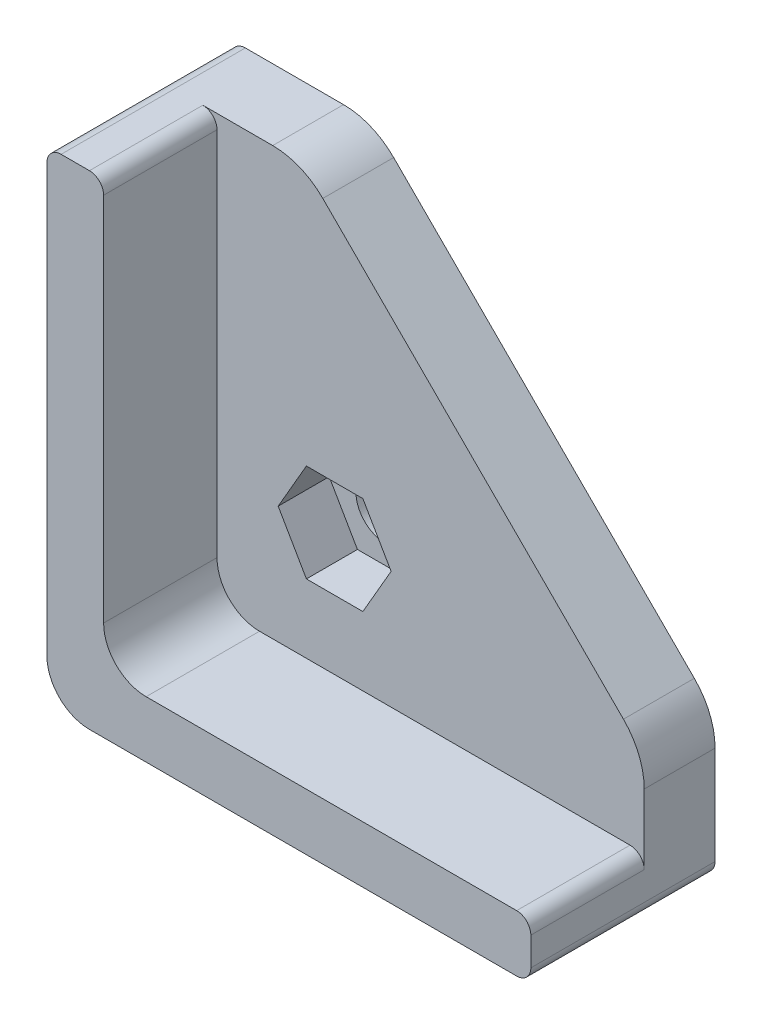
from build123d import *

# Parameters (mm, degrees)
SKETCH1_R           = 2.1
BOSS_EXTRUDE1_DEPTH = 5
BOSS_EXTRUDE2_DEPTH = 8
FILLET1_R           = 3
CUT_EXTRUDE1_DEPTH  = 3.6
FILLET2_R           = 5
FILLET3_R           = 1


with BuildPart() as part:
    # Sketch1 → Boss-Extrude1 (new body)
    with BuildSketch(Plane.XY):
        Polygon((257.428056395, -9.677220034), (223.285920771, -9.677220034), (223.285920771, 24.46491559), (233.285920771, 24.46491559), (257.428056395, 0.322779966), align=None)
        with Locations((235.585920771, 2.622779966)):
            Circle(SKETCH1_R, mode=Mode.SUBTRACT)
    extrude(amount=BOSS_EXTRUDE1_DEPTH)

    # Sketch2 → Boss-Extrude2 (add)
    with BuildSketch(Plane.XY.offset(5)):
        Polygon((257.428056395, -9.677220034), (223.285920771, -9.677220034), (223.285920771, 24.46491559), (227.285920771, 24.46491559), (227.285920771, -5.677220034), (257.428056395, -5.677220034), align=None)
    extrude(amount=BOSS_EXTRUDE2_DEPTH)

    # Fillet1
    fillet1_edges = [part.edges().sort_by_distance(p)[0] for p in [
        (227.285920771, -5.677220034, 9),
        (223.285920771, -9.677220034, 6.5),
    ]]
    fillet(fillet1_edges, radius=FILLET1_R)

    # Sketch3 → Cut-Extrude1 (cut)
    with BuildSketch(Plane.XY.offset(5)):
        Polygon((239.569637629, 2.622779966), (237.5777792, 6.072779966), (233.594062342, 6.072779966), (231.602203914, 2.622779966), (233.594062342, -0.827220034), (237.5777792, -0.827220034), align=None)
    extrude(amount=-CUT_EXTRUDE1_DEPTH, mode=Mode.SUBTRACT)

    # Fillet2
    fillet2_edges = [part.edges().sort_by_distance(p)[0] for p in [
        (233.285920771, 24.46491559, 2.5),
        (257.428056395, 0.322779966, 2.5),
    ]]
    fillet(fillet2_edges, radius=FILLET2_R)

    # Fillet3
    fillet3_edges = [part.edges().sort_by_distance(p)[0] for p in [
        (257.428056395, -5.677220034, 9),
        (227.285920771, 24.46491559, 9),
        (257.428056395, -9.677220034, 6.5),
        (223.285920771, 24.46491559, 6.5),
    ]]
    fillet(fillet3_edges, radius=FILLET3_R)


solid = part.part
